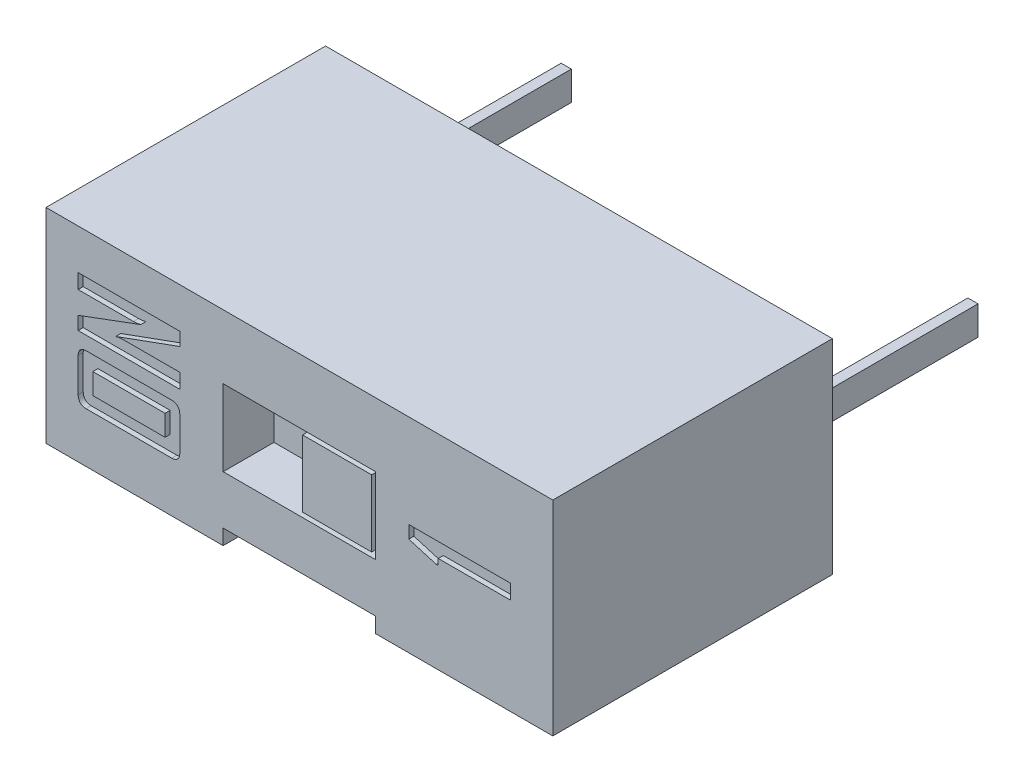
from build123d import *

# Parameters (mm, degrees)
BOSS_EXTRUDE1_DEPTH = 5.5
SKETCH2_W           = 3
SKETCH2_H           = 1.5
SKETCH2_W_2         = 1.358942276
SKETCH2_H_2         = 1.316057296
CUT_EXTRUDE1_DEPTH  = 1
SKETCH3_W           = 0.2
SKETCH3_H           = 0.57
BOSS_EXTRUDE2_DEPTH = 3.75
SKETCH4_W           = 1.421686747
SKETCH4_H           = 0.409638554
CUT_EXTRUDE2_DEPTH  = 0.1


with BuildPart() as part:
    # Sketch1 → Boss-Extrude1 (new body)
    with BuildSketch(Plane.XY):
        Polygon((-4.985, -2.01), (-1.5, -2.01), (-1.5, -1.71), (1.5, -1.71), (1.5, -2.01), (4.985, -2.01), (4.985, 2.01), (-4.985, 2.01), align=None)
    extrude(amount=BOSS_EXTRUDE1_DEPTH)

    # Sketch2 → Cut-Extrude1 (cut)
    with BuildSketch(Plane.XY.offset(5.5)):
        Rectangle(SKETCH2_W, SKETCH2_H)
        with Locations((0.741156602, 0)):
            Rectangle(SKETCH2_W_2, SKETCH2_H_2, mode=Mode.SUBTRACT)
    extrude(amount=-CUT_EXTRUDE1_DEPTH, mode=Mode.SUBTRACT)

    # Sketch3 → Boss-Extrude2 (add)
    with BuildSketch(Plane(origin=(0, 0, 0), x_dir=(-1, 0, 0), z_dir=(0, 0, -1))):
        with Locations((-4, 0)):
            Rectangle(SKETCH3_W, SKETCH3_H)
        with Locations((4, 0)):
            Rectangle(SKETCH3_W, SKETCH3_H)
    extrude(amount=BOSS_EXTRUDE2_DEPTH)

    # Sketch4 → Cut-Extrude2 (cut)
    # profile 1 of 3: a face of its own
    with BuildSketch(Plane.XY.offset(5.5)):
        with BuildLine():
            Line((-2.353314341, 1.216281942), (-2.353314341, 0.956492785))
            Line((-2.353314341, 0.956492785), (-3.611973979, 0.498284954))
            add(Edge.make_bspline(
                [(-3.611973979, 0.498284954), (-3.597433311, 0.501148384), (-3.570177198, 0.50651581), (-3.531507992, 0.512558558), (-3.497858896, 0.516745674), (-3.476943559, 0.517254487), (-3.467395666, 0.517486761)],
                knots=[0, 0, 0, 0, 1.217419203, 2.282021413, 3.215739318, 4, 4, 4, 4], degree=3))
            Line((-3.467395666, 0.517486761), (-2.353314341, 0.517486761))
            Line((-2.353314341, 0.517486761), (-2.353314341, 0.228330135))
            Line((-2.353314341, 0.228330135), (-4.353314341, 0.228330135))
            Line((-4.353314341, 0.228330135), (-4.353314341, 0.488119291))
            Line((-4.353314341, 0.488119291), (-3.120257112, 0.946327123))
            add(Edge.make_bspline(
                [(-3.120257112, 0.946327123), (-3.134669922, 0.943449375), (-3.161913736, 0.938009714), (-3.200482023, 0.932125999), (-3.234118261, 0.927844891), (-3.254910338, 0.927351775), (-3.264458919, 0.927125315)],
                knots=[0, 0, 0, 0, 1.210373155, 2.287907843, 3.213736571, 4, 4, 4, 4], degree=3))
            Line((-3.264458919, 0.927125315), (-4.353314341, 0.927125315))
            Line((-4.353314341, 0.927125315), (-4.353314341, 1.216281942))
            Line((-4.353314341, 1.216281942), (-2.353314341, 1.216281942))
        make_face()
    # profile 2 of 3: a face of its own
    with BuildSketch(Plane.XY.offset(5.5)):
        with BuildLine():
            add(Edge.make_bspline(
                [(-2.511070365, -0.036730106), (-2.49908555, -0.037580702), (-2.476448953, -0.039187284), (-2.444890766, -0.047711625), (-2.417445544, -0.060219475), (-2.395243748, -0.078659514), (-2.376803709, -0.10086131), (-2.364295859, -0.128306532), (-2.355771519, -0.159864718), (-2.354164936, -0.182501315), (-2.353314341, -0.19448613)],
                knots=[0, 0, 0, 0, 1.144701434, 2.162081395, 3.105417678, 4, 4.894582322, 5.837918605, 6.855298566, 8, 8, 8, 8], degree=3))
            Line((-2.353314341, -0.19448613), (-2.353314341, -0.866925889))
            add(Edge.make_bspline(
                [(-2.353314341, -0.866925889), (-2.354164936, -0.878910704), (-2.355771519, -0.901547302), (-2.364295859, -0.933105488), (-2.376803709, -0.96055071), (-2.395243748, -0.982752506), (-2.417445544, -1.001192545), (-2.444890766, -1.013700395), (-2.476448953, -1.022224736), (-2.49908555, -1.023831318), (-2.511070365, -1.024681914)],
                knots=[0, 0, 0, 0, 1.144701434, 2.162081395, 3.105417678, 4, 4.894582322, 5.837918605, 6.855298566, 8, 8, 8, 8], degree=3))
            Line((-2.511070365, -1.024681914), (-4.195558317, -1.024681914))
            add(Edge.make_bspline(
                [(-4.195558317, -1.024681914), (-4.207543132, -1.023831318), (-4.230179729, -1.022224736), (-4.261737915, -1.013700395), (-4.289183137, -1.001192545), (-4.311384933, -0.982752506), (-4.329824972, -0.96055071), (-4.342332823, -0.933105488), (-4.350857163, -0.901547302), (-4.352463745, -0.878910704), (-4.353314341, -0.866925889)],
                knots=[0, 0, 0, 0, 1.144701434, 2.162081395, 3.105417678, 4, 4.894582322, 5.837918605, 6.855298566, 8, 8, 8, 8], degree=3))
            Line((-4.353314341, -0.866925889), (-4.353314341, -0.19448613))
            add(Edge.make_bspline(
                [(-4.353314341, -0.19448613), (-4.352463745, -0.182501315), (-4.350857163, -0.159864718), (-4.342332823, -0.128306532), (-4.329824972, -0.10086131), (-4.311384933, -0.078659514), (-4.289183137, -0.060219475), (-4.261737915, -0.047711625), (-4.230179729, -0.039187284), (-4.207543132, -0.037580702), (-4.195558317, -0.036730106)],
                knots=[0, 0, 0, 0, 1.144701434, 2.162081395, 3.105417678, 4, 4.894582322, 5.837918605, 6.855298566, 8, 8, 8, 8], degree=3))
            Line((-4.195558317, -0.036730106), (-2.511070365, -0.036730106))
        make_face()
        with Locations((-3.35331434, -0.53070601)):
            Rectangle(SKETCH4_W, SKETCH4_H, mode=Mode.SUBTRACT)
    # profile 3 of 3: a face of its own
    with BuildSketch(Plane.XY.offset(5.5)):
        Polygon((4.152608675, 0.176962569), (4.152608675, -0.112194057), (2.730921928, -0.112194057), (2.730921928, -0.232675985), (2.694777349, -0.232675985), (2.152608675, -0.072660924), (2.152608675, 0.176962569), align=None)
    extrude(amount=-CUT_EXTRUDE2_DEPTH, mode=Mode.SUBTRACT)


solid = part.part
